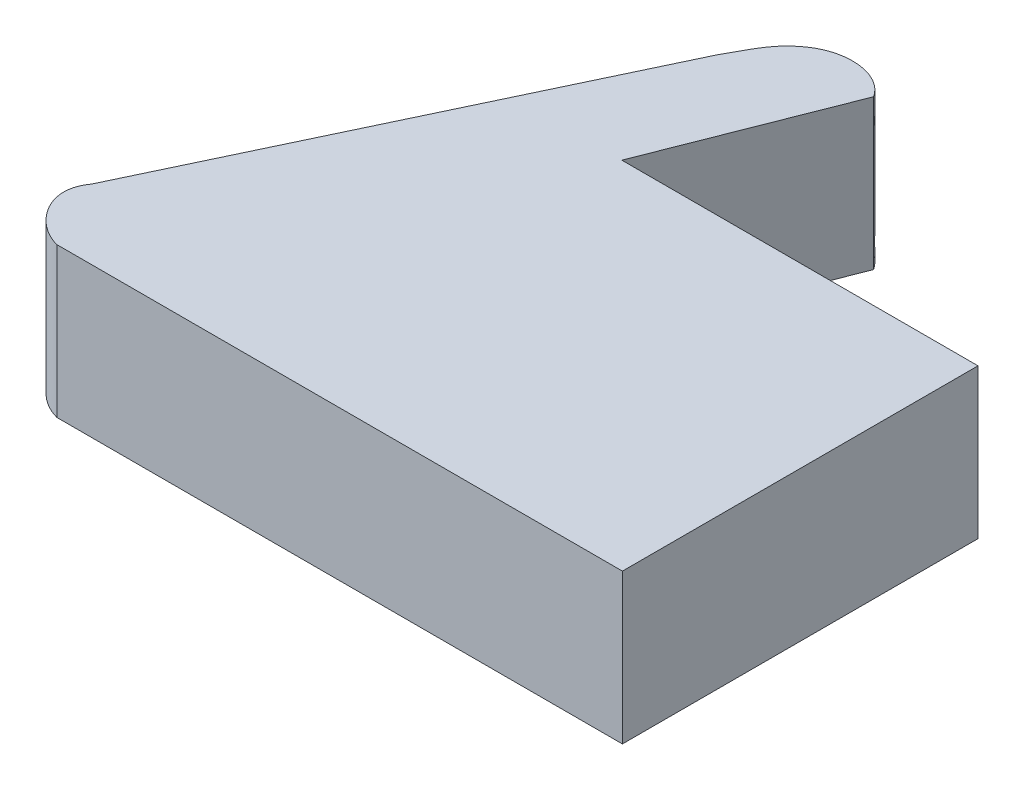
from build123d import *

# Parameters (mm, degrees)
BOSS_EXTRUDE1_DEPTH = 28


with BuildPart() as part:
    # Sketch1 → Boss-Extrude1 (new body)
    with BuildSketch(Plane(origin=(0, 0, 0), x_dir=(1, 0, 0), z_dir=(0, 1, 0))):
        with BuildLine():
            Line((0, 0), (105.760379504, 0))
            Line((105.760379504, 0), (105.760379504, 66.505760117))
            Line((105.760379504, 66.505760117), (39.146479939, 66.505760117))
            Line((39.146479939, 66.505760117), (52.415736455, 100.323934711))
            add(Edge.make_bspline(
                [(52.415736455, 100.323934711), (50.07713871, 103.942471785), (41.897556232, 105.536469955), (34.280133355, 99.294275572), (32.228567822, 94.566792302), (30.972636221, 92.447002695)],
                knots=[0, 0, 0, 0, 0.447115865, 0.733607522, 1, 1, 1, 1], degree=3))
            Line((30.972636221, 92.447002695), (-6.571045616, 13.050137499))
            add(Edge.make_bspline(
                [(-6.571045616, 13.050137499), (-10.402799403, 7.920582359), (-5.185472177, 1.285466499), (0, 0)],
                knots=[0, 0, 0, 0, 1, 1, 1, 1], degree=3))
        make_face()
    extrude(amount=BOSS_EXTRUDE1_DEPTH)


solid = part.part
